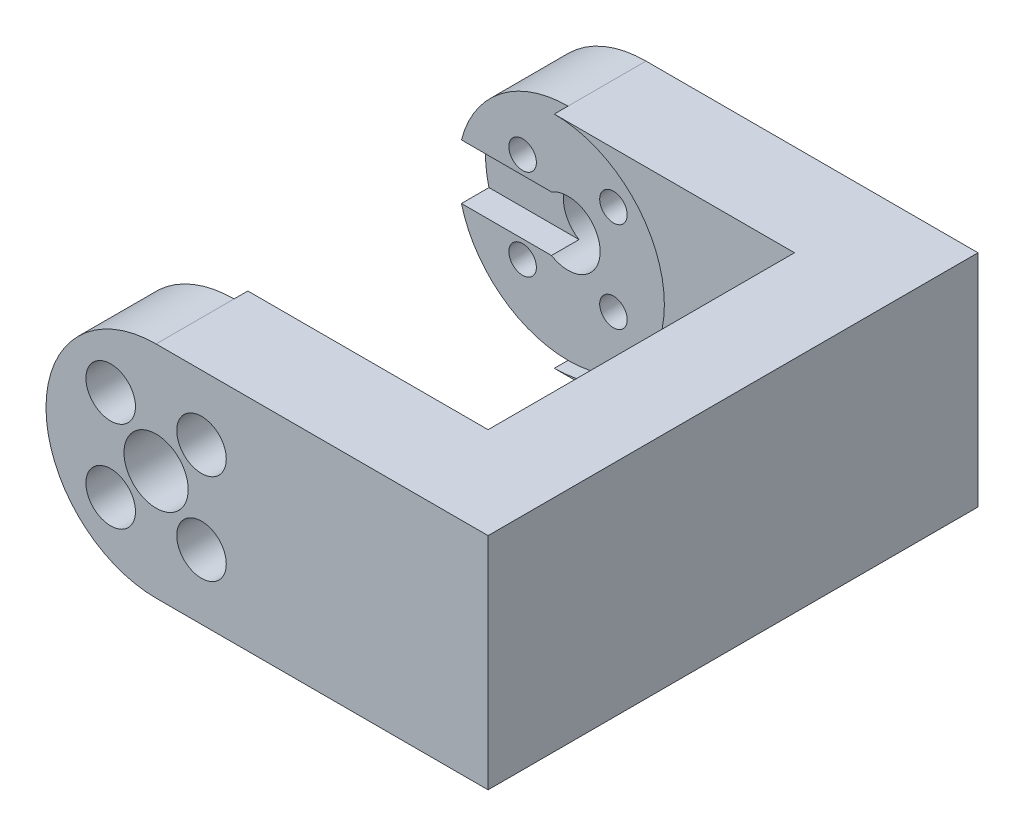
from build123d import *

# Parameters (mm, degrees)
EXTRUDE_1_DEPTH      = 13.5
SKETCH_5_R           = 10.1
CUT_EXTRUDE_2_DEPTH  = 1.5
SKETCH_7_R           = 3.5
CUT_EXTRUDE_3_DEPTH  = 37
SKETCH_9_R           = 1.5
CUT_EXTRUDE_4_DEPTH  = 24.5
SKETCH_11_W          = 60.4
SKETCH_11_H          = 24
EXTRUDE_2_DEPTH      = 10
SKETCH_12_R          = 2.7
CUT_EXTRUDE_5_DEPTH  = 8.5
SKETCH_18_R          = 12
CUT_EXTRUDE_9_DEPTH  = 1.5
SKETCH_19_W          = 14.67242397
SKETCH_19_H          = 6
CUT_EXTRUDE_10_DEPTH = 3
SKETCH_20_W          = 76.507524202
SKETCH_20_H          = 37.102074034
CUT_EXTRUDE_11_DEPTH = 3.5


with BuildPart() as part:
    # 草图1 → 凸台-拉伸1 (new body)
    with BuildSketch(Plane.XY):
        with BuildLine():
            Line((0, 12), (36.185307738, 12))
            Line((36.185307738, 12), (36.185307738, -12))
            Line((36.185307738, -12), (0, -12))
            ThreePointArc((0, -12), (-12, 0), (0, 12))
        make_face()
    extrude(amount=EXTRUDE_1_DEPTH)

    # 草图5 → 切除-拉伸2 (cut)
    with BuildSketch(Plane(origin=(0, 0, 0), x_dir=(-1, 0, 0), z_dir=(0, 0, -1))):
        Circle(SKETCH_5_R)
    extrude(amount=-CUT_EXTRUDE_2_DEPTH, mode=Mode.SUBTRACT)

    # 草图7 → 切除-拉伸3 (cut)
    with BuildSketch(Plane(origin=(0, 0, 1.5), x_dir=(-1, 0, 0), z_dir=(0, 0, -1))):
        Circle(SKETCH_7_R)
    extrude(amount=-CUT_EXTRUDE_3_DEPTH, mode=Mode.SUBTRACT)

    # 草图9 → 切除-拉伸4 (cut)
    with BuildSketch(Plane(origin=(0, 0, 1.5), x_dir=(-1, 0, 0), z_dir=(0, 0, -1))):
        with Locations((-4.949747468, 4.949747468)):
            Circle(SKETCH_9_R)
        with Locations((4.949747468, 4.949747468)):
            Circle(SKETCH_9_R)
        with Locations((4.949747468, -4.949747468)):
            Circle(SKETCH_9_R)
        with Locations((-4.949747468, -4.949747468)):
            Circle(SKETCH_9_R)
    extrude(amount=-CUT_EXTRUDE_4_DEPTH, mode=Mode.SUBTRACT)


with BuildPart() as body_2:
    # 镜向14: mirrored copy
    add(part.part.mirror(Plane(origin=(0, 0, -16.7), x_dir=(1, 0, 0), z_dir=(0, 0, -1))))


with BuildPart() as part_1:
    add(part.part)

    add(body_2.part)  # 凸台-拉伸2 merges body 2
    # 草图11 → 凸台-拉伸2 (add)
    with BuildSketch(Plane(origin=(36.185307738, 0, 0), x_dir=(0, 0, -1), z_dir=(1, 0, 0))):
        with Locations((16.7, 0)):
            Rectangle(SKETCH_11_W, SKETCH_11_H)
    extrude(amount=-EXTRUDE_2_DEPTH)

    # 草图12 → 切除-拉伸5 (cut)
    with BuildSketch(Plane.XY.offset(13.5)):
        with Locations((4.949747468, 4.949747468)):
            Circle(SKETCH_12_R)
        with Locations((4.949747468, -4.949747468)):
            Circle(SKETCH_12_R)
        with Locations((-4.949747468, -4.949747468)):
            Circle(SKETCH_12_R)
        with Locations((-4.949747468, 4.949747468)):
            Circle(SKETCH_12_R)
    cut_extrude_5 = extrude(amount=-CUT_EXTRUDE_5_DEPTH, mode=Mode.SUBTRACT)

    # 草图18 → 切除-拉伸9 (cut)
    with BuildSketch(Plane(origin=(0, 0, 0), x_dir=(-1, 0, 0), z_dir=(0, 0, -1))):
        Circle(SKETCH_18_R)
    cut_extrude_9 = extrude(amount=-CUT_EXTRUDE_9_DEPTH, mode=Mode.SUBTRACT)

    # 草图19 → 切除-拉伸10 (cut)
    with BuildSketch(Plane(origin=(0, 0, 1.5), x_dir=(-1, 0, 0), z_dir=(0, 0, -1))):
        with Locations((7.336211985, 0)):
            Rectangle(SKETCH_19_W, SKETCH_19_H)
    cut_extrude_10 = extrude(amount=-CUT_EXTRUDE_10_DEPTH, mode=Mode.SUBTRACT)

    # 草图20 → 切除-拉伸11 (cut)
    with BuildSketch(Plane.XY.offset(13.5)):
        with Locations((20.283666709, 0.248055891)):
            Rectangle(SKETCH_20_W, SKETCH_20_H)
    cut_extrude_11 = extrude(amount=-CUT_EXTRUDE_11_DEPTH, mode=Mode.SUBTRACT)

    # 镜向24: 切除-拉伸5, 切除-拉伸9, 切除-拉伸10 across plane
    add(cut_extrude_5.mirror(Plane(origin=(0, 0, -16.7), x_dir=(1, 0, 0), z_dir=(0, 0, -1))), mode=Mode.SUBTRACT)
    add(cut_extrude_9.mirror(Plane(origin=(0, 0, -16.7), x_dir=(1, 0, 0), z_dir=(0, 0, -1))), mode=Mode.SUBTRACT)
    add(cut_extrude_10.mirror(Plane(origin=(0, 0, -16.7), x_dir=(1, 0, 0), z_dir=(0, 0, -1))), mode=Mode.SUBTRACT)

    # 镜向26: 切除-拉伸11 across plane
    add(cut_extrude_11.mirror(Plane(origin=(0, 0, -16.7), x_dir=(1, 0, 0), z_dir=(0, 0, -1))), mode=Mode.SUBTRACT)


solid = part_1.part
